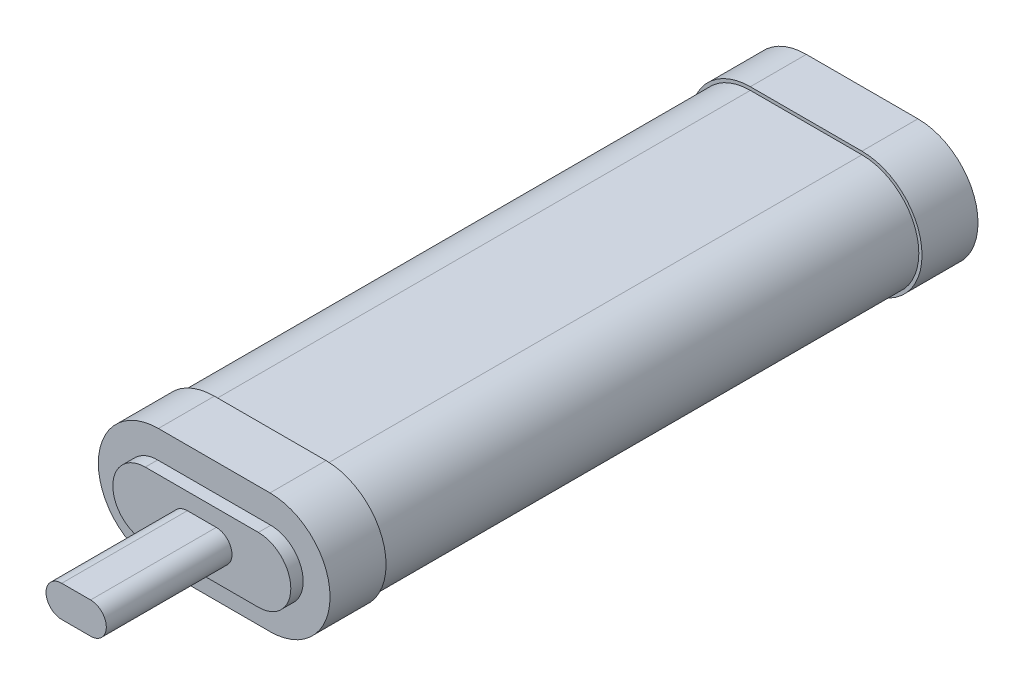
from build123d import *

# Parameters (mm, degrees)
BOSS_EXTRUDE1_DEPTH = 64.45
BOSS_EXTRUDE2_DEPTH = 11.14
BOSS_EXTRUDE3_DEPTH = 2.46
BOSS_EXTRUDE4_DEPTH = 25


with BuildPart() as part:
    # Sketch1 → Boss-Extrude1 (new, symmetric)
    with BuildSketch(Plane.XY):
        with BuildLine():
            Line((-11.1, 11.315), (11.1, 11.315))
            ThreePointArc((11.1, 11.315), (22.415, 0), (11.1, -11.315))
            Line((11.1, -11.315), (-11.1, -11.315))
            ThreePointArc((-11.1, -11.315), (-22.415, 0), (-11.1, 11.315))
        make_face()
    extrude(amount=BOSS_EXTRUDE1_DEPTH, both=True)

    # Sketch2 → Boss-Extrude2 (add)
    with BuildSketch(Plane.XY.offset(64.45)):
        with BuildLine():
            Line((-11.1, -11.95), (11.1, -11.95))
            ThreePointArc((11.1, -11.95), (23.05, 0), (11.1, 11.95))
            Line((11.1, 11.95), (-11.1, 11.95))
            ThreePointArc((-11.1, 11.95), (-23.05, 0), (-11.1, -11.95))
        make_face()
    boss_extrude2 = extrude(amount=-BOSS_EXTRUDE2_DEPTH)

    # Mirror1: Boss-Extrude2 across plane
    add(boss_extrude2.mirror(Plane.XY))

    # Sketch3 → Boss-Extrude3 (add)
    with BuildSketch(Plane.XY.offset(64.45)):
        with BuildLine():
            Line((-11.25, 6.45), (11.25, 6.45))
            ThreePointArc((11.25, 6.45), (17.7, 0), (11.25, -6.45))
            Line((11.25, -6.45), (-11.25, -6.45))
            ThreePointArc((-11.25, -6.45), (-17.7, 0), (-11.25, 6.45))
        make_face()
    extrude(amount=BOSS_EXTRUDE3_DEPTH)

    # Sketch4 → Boss-Extrude4 (add)
    with BuildSketch(Plane.XY.offset(66.91)):
        with BuildLine():
            Line((-2.875, 3.125), (2.875, 3.125))
            ThreePointArc((2.875, 3.125), (6, 0), (2.875, -3.125))
            Line((2.875, -3.125), (-2.875, -3.125))
            ThreePointArc((-2.875, -3.125), (-6, 0), (-2.875, 3.125))
        make_face()
    extrude(amount=BOSS_EXTRUDE4_DEPTH)


solid = part.part
